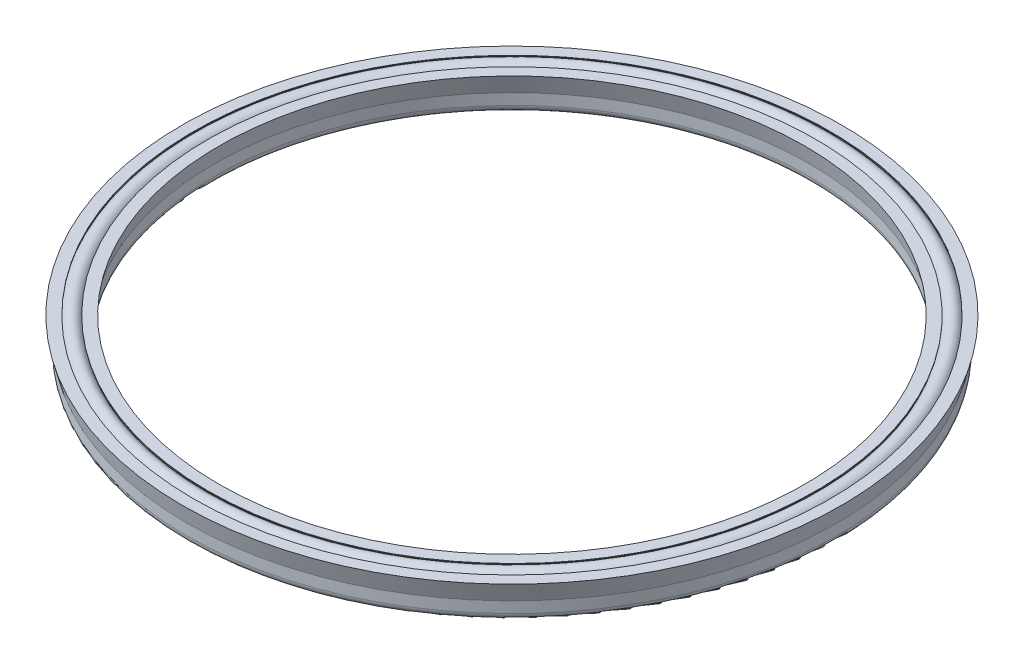
from build123d import *

# Parameters (mm, degrees)
SKETCH1_R = 1.468435222


with BuildPart() as part:
    # Sketch1 → Revolve1 (revolve)
    with BuildSketch(Plane.XY, mode=Mode.PRIVATE) as revolve1_sk:
        with Locations((-53.974995075, -1.136070965)):
            Circle(SKETCH1_R)
        with BuildLine():
            Line((-55.086243351, -6.248390307), (-52.863746798, -6.248390307))
            ThreePointArc((-52.863746798, -6.248390307), (-51.965722579, -5.876416496), (-51.593748769, -4.978392277))
            Line((-51.593748769, -4.978392277), (-51.593748769, -3.073395232))
            Line((-51.593748769, -3.073395232), (-50.8, 0))
            Line((-50.8, 0), (-52.753843123, 0))
            Line((-52.753843123, 0), (-52.753843123, -0.121705971))
            ThreePointArc((-52.753843123, -0.121705971), (-53.974995075, -2.723568502), (-55.196147026, -0.121705971))
            Line((-55.196147026, -0.121705971), (-55.196147026, 0))
            Line((-55.196147026, 0), (-57.149990149, 0))
            Line((-57.149990149, 0), (-56.35624138, -3.073395232))
            Line((-56.35624138, -3.073395232), (-56.35624138, -4.978392277))
            ThreePointArc((-56.35624138, -4.978392277), (-55.98426757, -5.876416496), (-55.086243351, -6.248390307))
        make_face()
    revolve(revolve1_sk.sketch.rotate(Axis((0, 0, 0), (0, -1, 0)), 270), axis=Axis((0, 0, 0), (0, -1, 0)))


solid = part.part
